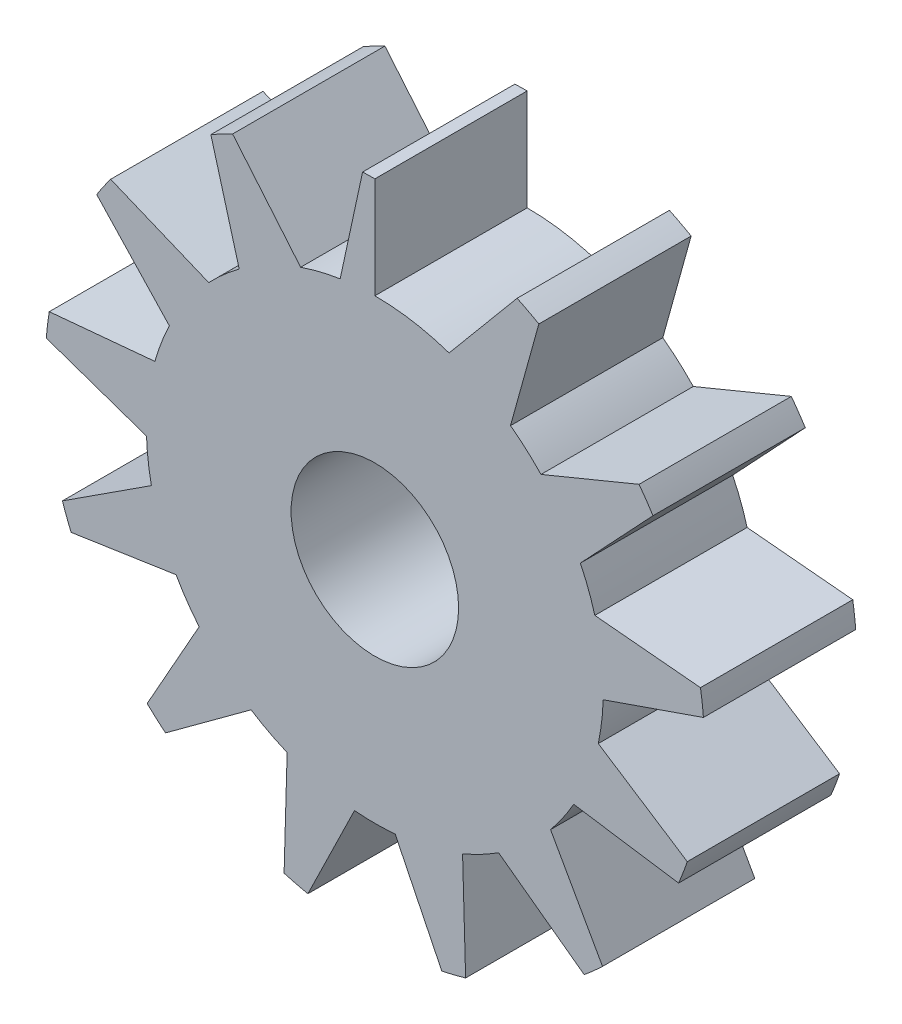
from build123d import *

# Parameters (mm, degrees)
BOSS_EXTRUDE1_DEPTH = 10


with BuildPart() as part:
    # Sketch1 → Boss-Extrude1 (new body)
    with BuildSketch(Plane.XY):
        with BuildLine():
            Line((0, 15), (0, 21.65))
            ThreePointArc((0, 21.65), (-0.40286299, 21.64625144), (-0.805586474, 21.635007059))
            Line((-0.805586474, 21.635007059), (-2.277654316, 14.826067949))
            ThreePointArc((-2.277654316, 14.826067949), (-3.589734964, 14.564127261), (-4.873254588, 14.18630994))
            Line((-4.873254588, 14.18630994), (-9.34097771, 19.531222067))
            ThreePointArc((-9.34097771, 19.531222067), (-10.061256675, 19.170122955), (-10.767600505, 18.782472664))
            Line((-10.767600505, 18.782472664), (-8.906780064, 12.069352464))
            ThreePointArc((-8.906780064, 12.069352464), (-9.946839874, 11.227661223), (-10.907759595, 10.296639288))
            Line((-10.907759595, 10.296639288), (-17.347636471, 12.953069476))
            ThreePointArc((-17.347636471, 12.953069476), (-17.817600697, 12.298601767), (-18.262887024, 11.627100134))
            Line((-18.262887024, 11.627100134), (-13.495469838, 6.547693781))
            ThreePointArc((-13.495469838, 6.547693781), (-14.02524364, 5.319073306), (-14.443428331, 4.048132663))
            Line((-14.443428331, 4.048132663), (-21.380160779, 3.40752477))
            ThreePointArc((-21.380160779, 3.40752477), (-21.492147124, 2.609619128), (-21.574366218, 1.808099086))
            Line((-21.574366218, 1.808099086), (-14.992510111, -0.473962639))
            ThreePointArc((-14.992510111, -0.473962639), (-14.890633111, -1.808050204), (-14.670281698, -3.12775237))
            Line((-14.670281698, -3.12775237), (-20.514747911, -6.918642796))
            ThreePointArc((-20.514747911, -6.918642796), (-20.243101654, -7.677195804), (-19.94341811, -8.425115673))
            Line((-19.94341811, -8.425115673), (-13.054946996, -7.38703993))
            ThreePointArc((-13.054946996, -7.38703993), (-12.344757988, -8.520971201), (-11.536350325, -9.587107028))
            Line((-11.536350325, -9.587107028), (-14.949653526, -15.659832676))
            ThreePointArc((-14.949653526, -15.659832676), (-14.356605551, -16.205257698), (-13.743673257, -16.728237964))
            Line((-13.743673257, -16.728237964), (-8.126652854, -12.607835397))
            ThreePointArc((-8.126652854, -12.607835397), (-6.970847581, -13.281840385), (-5.75958012, -13.850171004))
            Line((-5.75958012, -13.850171004), (-5.959773682, -20.813543611))
            ThreePointArc((-5.959773682, -20.813543611), (-5.181184132, -21.020890347), (-4.395418491, -21.199122536))
            Line((-4.395418491, -21.199122536), (-1.336640479, -14.940327715))
            ThreePointArc((-1.336640479, -14.940327715), (0, -15), (1.336640479, -14.940327715))
            Line((1.336640479, -14.940327715), (4.395418491, -21.199122536))
            ThreePointArc((4.395418491, -21.199122536), (5.181184132, -21.020890347), (5.959773682, -20.813543611))
            Line((5.959773682, -20.813543611), (5.75958012, -13.850171004))
            ThreePointArc((5.75958012, -13.850171004), (6.970847581, -13.281840385), (8.126652854, -12.607835397))
            Line((8.126652854, -12.607835397), (13.743673257, -16.728237964))
            ThreePointArc((13.743673257, -16.728237964), (14.356605551, -16.205257698), (14.949653526, -15.659832676))
            Line((14.949653526, -15.659832676), (11.536350325, -9.587107028))
            ThreePointArc((11.536350325, -9.587107028), (12.344757988, -8.520971201), (13.054946996, -7.38703993))
            Line((13.054946996, -7.38703993), (19.94341811, -8.425115673))
            ThreePointArc((19.94341811, -8.425115673), (20.243101654, -7.677195804), (20.514747911, -6.918642796))
            Line((20.514747911, -6.918642796), (14.670281698, -3.12775237))
            ThreePointArc((14.670281698, -3.12775237), (14.890633111, -1.808050204), (14.992510111, -0.473962639))
            Line((14.992510111, -0.473962639), (21.574366218, 1.808099086))
            ThreePointArc((21.574366218, 1.808099086), (21.492147124, 2.609619128), (21.380160779, 3.40752477))
            Line((21.380160779, 3.40752477), (14.443428331, 4.048132663))
            ThreePointArc((14.443428331, 4.048132663), (14.02524364, 5.319073306), (13.495469838, 6.547693781))
            Line((13.495469838, 6.547693781), (18.262887024, 11.627100134))
            ThreePointArc((18.262887024, 11.627100134), (17.817600697, 12.298601767), (17.347636471, 12.953069476))
            Line((17.347636471, 12.953069476), (10.907759595, 10.296639288))
            ThreePointArc((10.907759595, 10.296639288), (9.946839874, 11.227661223), (8.906780064, 12.069352464))
            Line((8.906780064, 12.069352464), (10.767600505, 18.782472664))
            ThreePointArc((10.767600505, 18.782472664), (10.061256675, 19.170122955), (9.34097771, 19.531222067))
            Line((9.34097771, 19.531222067), (4.873254588, 14.18630994))
            ThreePointArc((4.873254588, 14.18630994), (3.589734964, 14.564127261), (2.277654316, 14.826067949))
            ThreePointArc((2.277654316, 14.826067949), (1.142142892, 14.956453778), (0, 15))
        make_face()
        with BuildLine():
            ThreePointArc((5.5, 0), (-3.889087297, -3.889087297), (0, 5.5))
            ThreePointArc((0, 5.5), (3.889087297, 3.889087297), (5.5, 0))
        make_face(mode=Mode.SUBTRACT)
    extrude(amount=BOSS_EXTRUDE1_DEPTH)


solid = part.part
